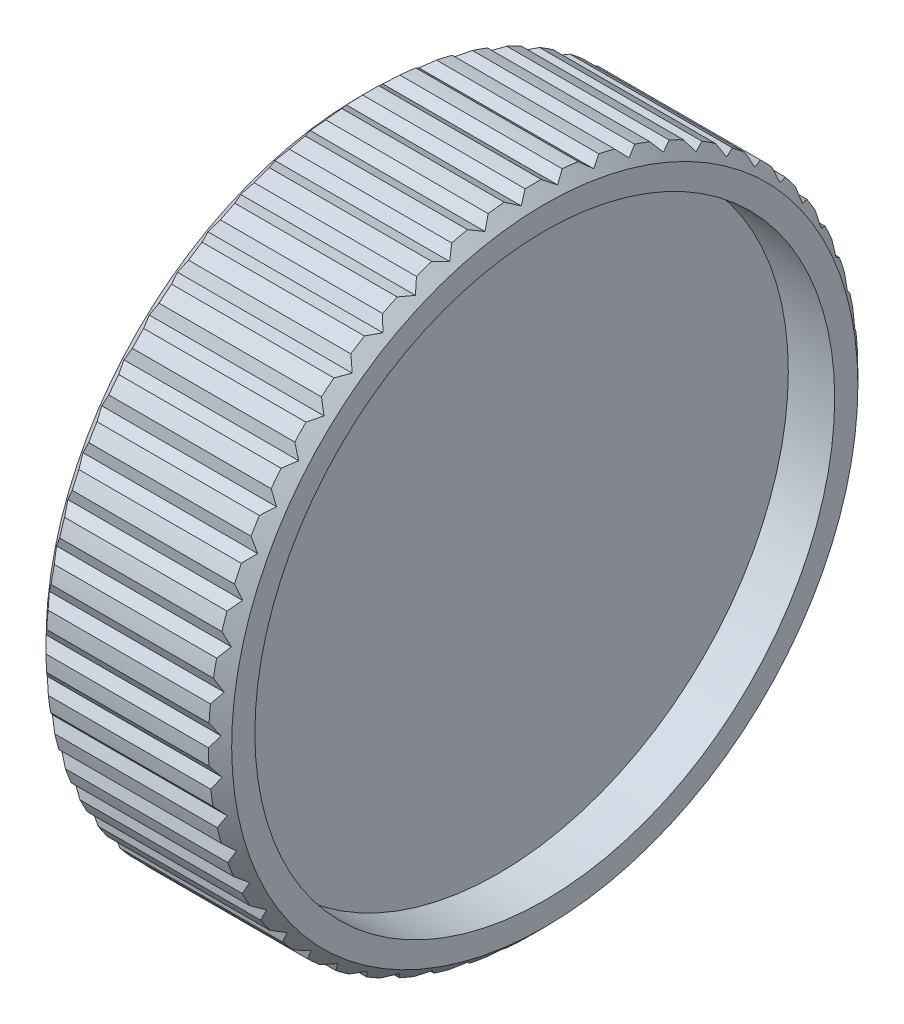
from build123d import *

# Parameters (mm, degrees)
SKETCH1_R           = 28
BOSS_EXTRUDE1_DEPTH = 8
CHAMFER1_SIZE       = 1
SKETCH3_R           = 25
CUT_EXTRUDE2_DEPTH  = 4
CUT_EXTRUDE3_DEPTH  = 43.708313008
CIRPATTERN1_COUNT   = 55


with BuildPart() as part:
    # Sketch1 → Boss-Extrude1 (new, symmetric)
    with BuildSketch(Plane(origin=(0, 0, 0), x_dir=(0, 0, -1), z_dir=(1, 0, 0))):
        Circle(SKETCH1_R)
    extrude(amount=BOSS_EXTRUDE1_DEPTH, both=True)

    # Chamfer1
    chamfer1_edges = [part.edges().sort_by_distance(p)[0] for p in [
        (-8, 0, 28),
        (8, 0, 28),
    ]]
    chamfer(chamfer1_edges, length=CHAMFER1_SIZE)

    # Sketch3 → Cut-Extrude2 (cut)
    with BuildSketch(Plane(origin=(8, 0, 0), x_dir=(0, 0, -1), z_dir=(1, 0, 0))):
        Circle(SKETCH3_R)
    cut_extrude2 = extrude(amount=-CUT_EXTRUDE2_DEPTH, mode=Mode.SUBTRACT)

    # Mirror1: Cut-Extrude2 across plane
    add(cut_extrude2.mirror(Plane(origin=(0, 0, 0), x_dir=(0, 0, 1), z_dir=(1, 0, 0))), mode=Mode.SUBTRACT)

    # Sketch4 → Cut-Extrude3 (cut, through all)
    with BuildSketch(Plane(origin=(8, 0, 0), x_dir=(0, 0, -1), z_dir=(1, 0, 0))):
        Polygon((0, -27.464101615), (-8.660254038, -32.464101615), (8.660254038, -32.464101615), align=None)
    cut_extrude3 = extrude(amount=-CUT_EXTRUDE3_DEPTH, mode=Mode.SUBTRACT)

    # CirPattern1: Cut-Extrude3 ×55 about axis
    cirpattern1_axis = Axis((0, 0, 0), (1, 0, 0))
    for i in range(1, CIRPATTERN1_COUNT):
        add(cut_extrude3.rotate(cirpattern1_axis, i * 360 / CIRPATTERN1_COUNT), mode=Mode.SUBTRACT)


solid = part.part
